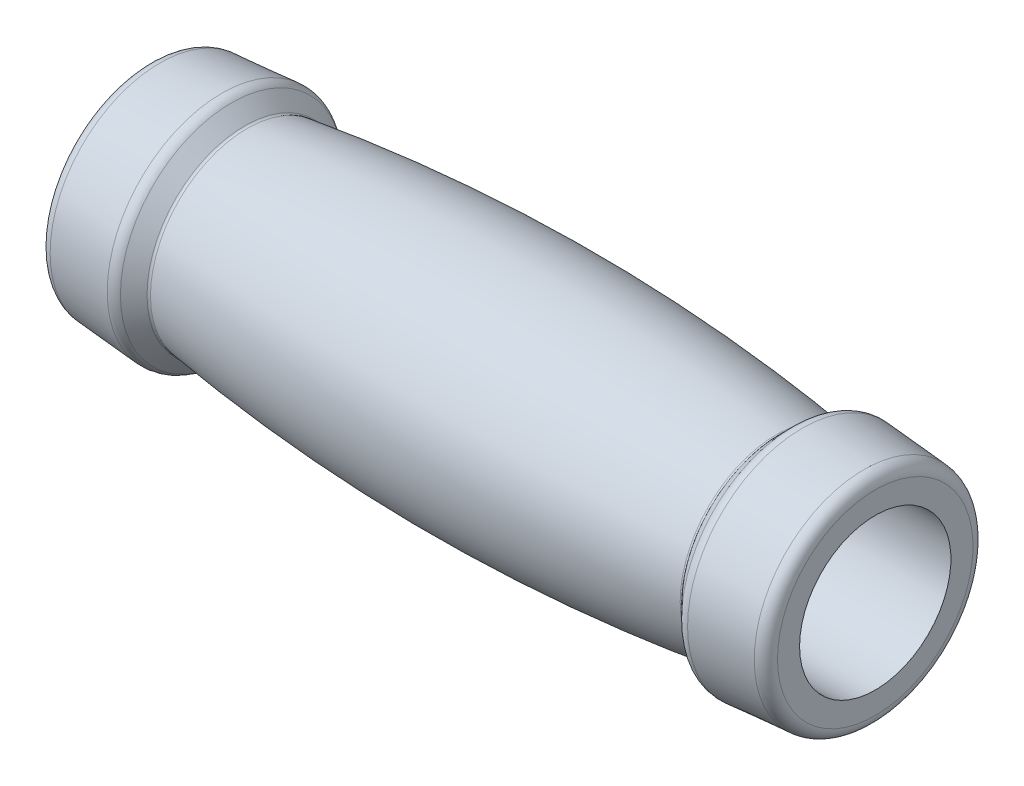
from build123d import *


with BuildPart() as part:
    # Esquisse1 → Révolution1 (revolve)
    with BuildSketch(Plane.XY, mode=Mode.PRIVATE) as r_volution1_sk:
        with BuildLine():
            Line((-60, 12.5), (60, 12.5))
            Line((60, 12.5), (60, 16.147937721))
            ThreePointArc((60, 16.147937721), (59.467444376, 17.506836909), (58.153392998, 18.142046692))
            Line((58.153392998, 18.142046692), (47.929868284, 18.92847167))
            ThreePointArc((47.929868284, 18.92847167), (47.072749688, 18.80646587), (46.347498309, 18.333657092))
            Line((46.347498309, 18.333657092), (44.176495931, 16.116602244))
            ThreePointArc((44.176495931, 16.116602244), (43.980718422, 15.993215008), (43.750352643, 15.971195672))
            ThreePointArc((43.750352643, 15.971195672), (0, 19), (-43.750352643, 15.971195672))
            ThreePointArc((-43.750352643, 15.971195672), (-43.980718422, 15.993215008), (-44.176495931, 16.116602244))
            Line((-44.176495931, 16.116602244), (-46.347498309, 18.333657092))
            ThreePointArc((-46.347498309, 18.333657092), (-47.072749688, 18.80646587), (-47.929868284, 18.92847167))
            Line((-47.929868284, 18.92847167), (-58.153392998, 18.142046692))
            ThreePointArc((-58.153392998, 18.142046692), (-59.467444376, 17.506836909), (-60, 16.147937721))
            Line((-60, 16.147937721), (-60, 12.5))
        make_face()
    revolve(r_volution1_sk.sketch.rotate(Axis((0, 0, 0), (1, 0, 0)), 90), axis=Axis((0, 0, 0), (1, 0, 0)))


solid = part.part
